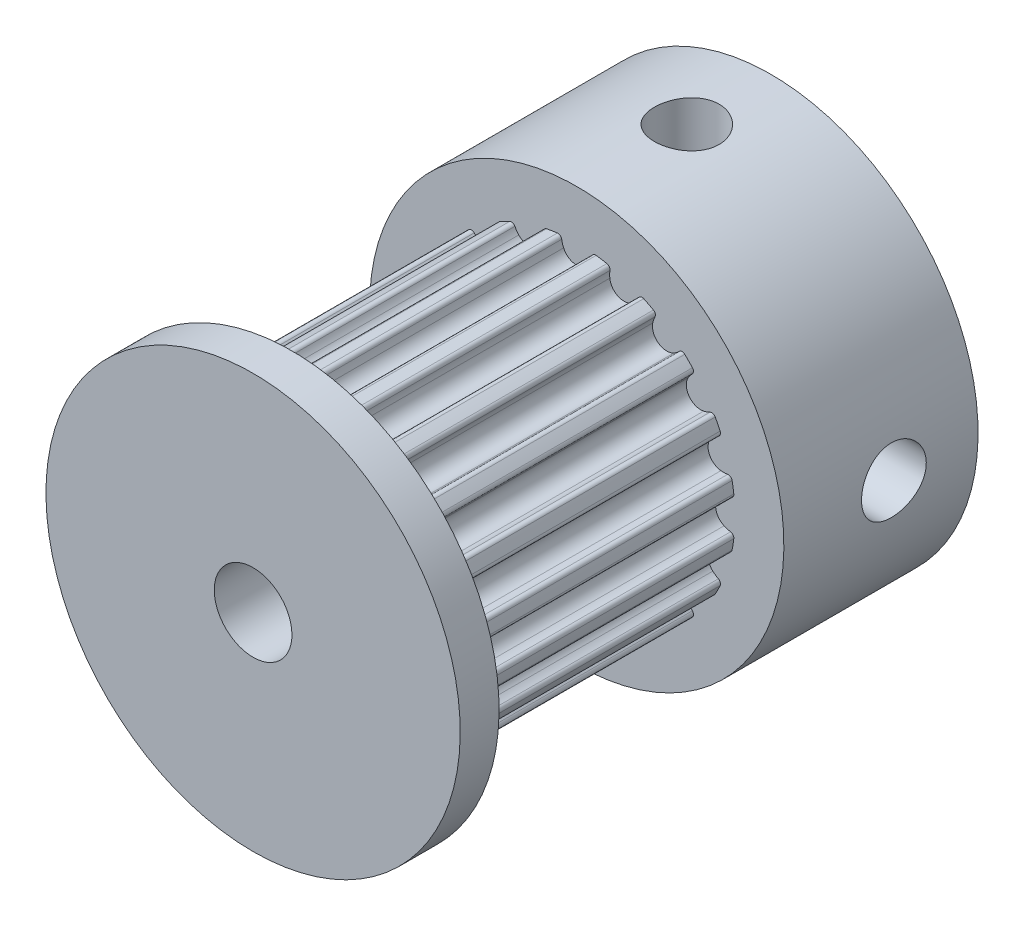
from build123d import *

# Parameters (mm, degrees)
CUT_EXTRUDE1_START  = 11
CUT_EXTRUDE1_DEPTH  = 11
CIRPATTERN1_COUNT   = 20
SKETCH3_R           = 8
SKETCH3_R_2         = 1.5
BOSS_EXTRUDE1_DEPTH = 6
SKETCH5_W           = 1.25
SKETCH5_H           = 8
CIRPATTERN2_COUNT   = 2
CIRPATTERN2_ANGLE   = 90


with BuildPart() as part:
    # Sketch1 → Revolve1 (revolve)
    with BuildSketch(Plane.YZ, mode=Mode.PRIVATE) as revolve1_sk:
        Polygon((1.5, -14), (8, -14), (8, -12.5), (6.112197725, -12.5), (6.112197725, -1.5), (8, -1.5), (8, 0), (1.5, 0), align=None)
    revolve(revolve1_sk.sketch.rotate(Axis((0, 0, 0), (0, 0, -1)), 180), axis=Axis((0, 0, 0), (0, 0, -1)))

    # Sketch2 → Cut-Extrude1 (cut)
    with BuildSketch(Plane.XY.offset(-12.5).offset(CUT_EXTRUDE1_START)):
        with BuildLine():
            ThreePointArc((-0.747662019, 6.066297267), (-0.639140162, 6.037293457), (-0.581188416, 5.941065553))
            ThreePointArc((-0.581188416, 5.941065553), (-0.552168525, 5.813522036), (-0.506749498, 5.690857392))
            ThreePointArc((-0.506749498, 5.690857392), (0, 5.362197725), (0.506749498, 5.690857392))
            ThreePointArc((0.506749498, 5.690857392), (0.552168525, 5.813522036), (0.581188416, 5.941065553))
            ThreePointArc((0.581188416, 5.941065553), (0.639140162, 6.037293457), (0.747662019, 6.066297267))
            ThreePointArc((0.747662019, 6.066297267), (0, 6.112197725), (-0.747662019, 6.066297267))
        make_face()
    cut_extrude1 = extrude(amount=-CUT_EXTRUDE1_DEPTH, mode=Mode.SUBTRACT)

    # CirPattern1: Cut-Extrude1 ×20 about axis
    cirpattern1_axis = Axis((0, 0, 0), (0, 0, 1))
    for i in range(1, CIRPATTERN1_COUNT):
        add(cut_extrude1.rotate(cirpattern1_axis, i * 360 / CIRPATTERN1_COUNT), mode=Mode.SUBTRACT)

    # Sketch3 → Boss-Extrude1 (add)
    with BuildSketch(Plane(origin=(0, 0, -14), x_dir=(1, 0, 0), z_dir=(0, 0, -1))):
        with Locations(Location((0, 0, 0), (0, 0, 90))):
            Circle(SKETCH3_R)
        with Locations(Location((0, 0, 0), (0, 0, 90))):
            Circle(SKETCH3_R_2, mode=Mode.SUBTRACT)
    extrude(amount=BOSS_EXTRUDE1_DEPTH)

    # Sketch5 → M3 Tapped Hole1 (revolve, cut)
    with BuildSketch(Plane(origin=(0, 0, -16.75), x_dir=(0, 0, 1), z_dir=(0, 1, 0))):
        with Locations((0.625, 4)):
            Rectangle(SKETCH5_W, SKETCH5_H)
    m3_tapped_hole1 = revolve(axis=Axis((-6.35, 0, -16.75), (1, 0, 0)), mode=Mode.SUBTRACT)

    # CirPattern2: M3 Tapped Hole1 ×2 about axis
    cirpattern2_axis = Axis((0, 0, 0), (0, 0, 1))
    for i in range(1, CIRPATTERN2_COUNT):
        add(m3_tapped_hole1.rotate(cirpattern2_axis, i * CIRPATTERN2_ANGLE / (CIRPATTERN2_COUNT - 1)), mode=Mode.SUBTRACT)


solid = part.part
